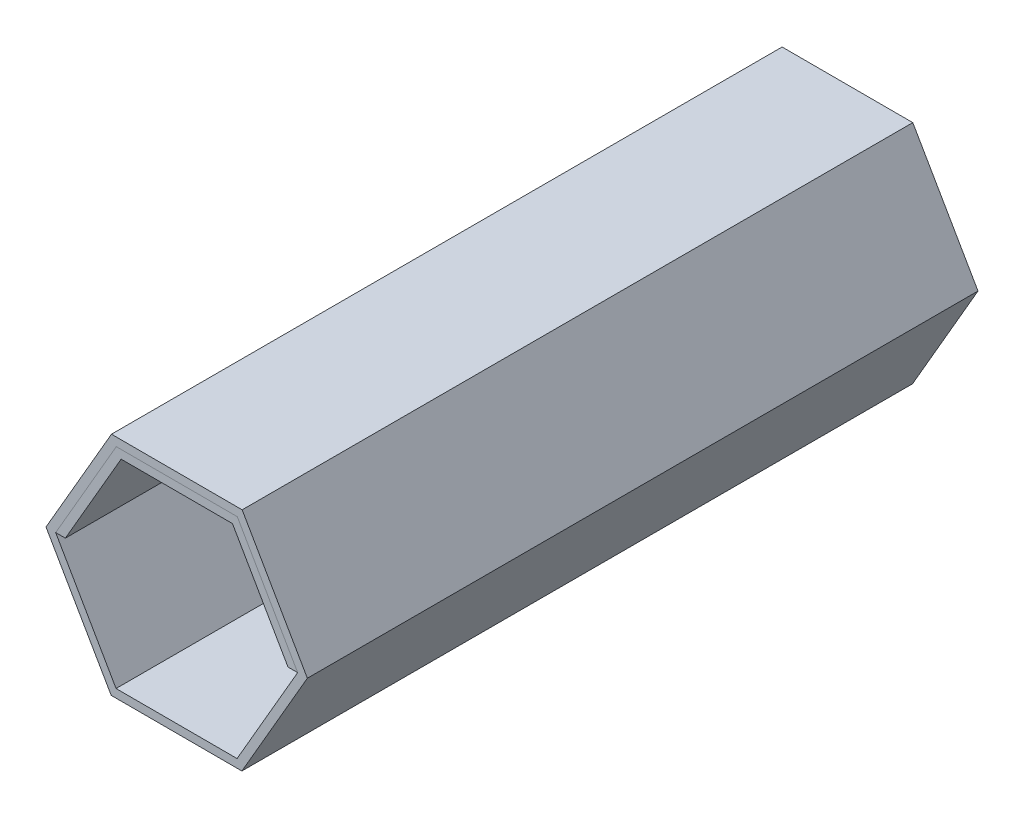
from build123d import *

# Parameters (mm, degrees)
BOSS_EXTRUDE1_DEPTH = 80
BOSS_EXTRUDE2_DEPTH = 80


with BuildPart() as part:
    # Sketch1 → Boss-Extrude1 (new body)
    with BuildSketch(Plane.XY):
        Polygon((8.098458923, 12.990315485), (7.810382493, 13.49066067), (-7.778063607, 13.509319987), (-8.067337033, 13.009665888), (-15.299172675, 0.518313416), (-15.588446101, 0.018659317), (-7.810382493, -13.49066067), (7.778063607, -13.509319987), (15.588446101, -0.018659317), (15.300369671, 0.481685867), align=None)
        Polygon((-7.201910748, 12.508629618), (7.231835642, 12.491352472), (14.433746389, -0.017277146), (7.201910748, -12.508629618), (-7.231835642, -12.491352472), (-14.433746389, 0.017277146), align=None, mode=Mode.SUBTRACT)
    extrude(amount=BOSS_EXTRUDE1_DEPTH)


with BuildPart() as body_2:
    # Sketch1<3> → Boss-Extrude2 (new body)
    with BuildSketch(Plane.XY):
        Polygon((14.433746389, -0.017277146), (7.231835642, 12.491352472), (-7.201910748, 12.508629618), (-14.433746389, 0.017277146), (-13.278246474, 0.017277146), (-6.625757888, 11.507939248), (6.65328879, 11.492044274), (13.279842471, -0.017277146), align=None)
    extrude(amount=BOSS_EXTRUDE2_DEPTH)


solid = Compound([part.part, body_2.part])
